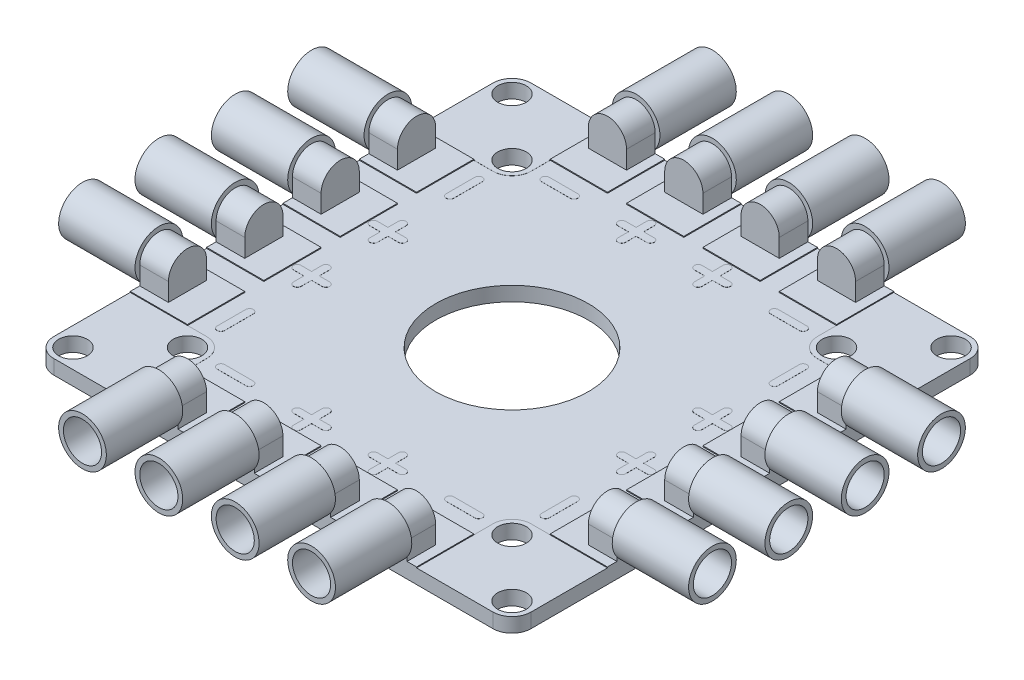
from build123d import *

# Parameters (mm, degrees)
SKETCH1_W           = 50
SKETCH1_H           = 50
SKETCH1_R           = 8
BOSS_EXTRUDE1_DEPTH = 1.5
SKETCH3_R           = 1.5
CUT_EXTRUDE1_DEPTH  = 36.387144558
FILLET2_R           = 2
BOSS_EXTRUDE3_DEPTH = 3
SKETCH6_R           = 2.5
BOSS_EXTRUDE4_DEPTH = 8
SKETCH7_R           = 2
CUT_EXTRUDE4_DEPTH  = 7.5
SKETCH8_W           = 6
SKETCH8_H           = 6
BOSS_EXTRUDE5_DEPTH = 0.1
BOSS_EXTRUDE6_START = 0.01
SKETCH9_R           = 1.5
BOSS_EXTRUDE6_DEPTH = 0.01
BOSS_EXTRUDE7_DEPTH = 0.01
CIRPATTERN1_COUNT   = 4
CIRPATTERN3_COUNT   = 4
CIRPATTERN4_COUNT   = 4
CIRPATTERN5_COUNT   = 4


with BuildPart() as part:
    # Sketch1 → Boss-Extrude1 (new body)
    with BuildSketch(Plane(origin=(0, 0, 0), x_dir=(1, 0, 0), z_dir=(0, 1, 0))):
        Rectangle(SKETCH1_W, SKETCH1_H)
        Circle(SKETCH1_R, mode=Mode.SUBTRACT)
    extrude(amount=BOSS_EXTRUDE1_DEPTH)

    # Sketch3 → Cut-Extrude1 (cut, through all)
    with BuildSketch(Plane(origin=(0, 1.5, 0), x_dir=(1, 0, 0), z_dir=(0, 1, 0))):
        with Locations((-23, -23)):
            Circle(SKETCH3_R)
        with Locations((-17, -17)):
            Circle(SKETCH3_R)
        with Locations((23, -23)):
            Circle(SKETCH3_R)
        with Locations((17, -17)):
            Circle(SKETCH3_R)
        with Locations((23, 23)):
            Circle(SKETCH3_R)
        with Locations((17, 17)):
            Circle(SKETCH3_R)
        with Locations((-23, 23)):
            Circle(SKETCH3_R)
        with Locations((-17, 17)):
            Circle(SKETCH3_R)
    extrude(amount=-CUT_EXTRUDE1_DEPTH, mode=Mode.SUBTRACT)

    # Fillet2
    fillet2_edges = [part.edges().sort_by_distance(p)[0] for p in [
        (25, 0.75, -25),
        (25, 0.75, 25),
        (-25, 0.75, -25),
        (-25, 0.75, 25),
    ]]
    fillet(fillet2_edges, radius=FILLET2_R)

    # Sketch5 → Boss-Extrude3 (add)
    with BuildSketch(Plane.XY.offset(25)):
        with BuildLine():
            Line((-6, 1.5), (-2, 1.5))
            Line((-2, 1.5), (-2, 3.5))
            ThreePointArc((-2, 3.5), (-4, 5.5), (-6, 3.5))
            Line((-6, 3.5), (-6, 1.5))
        make_face()
        with BuildLine():
            Line((10, 3.5), (10, 1.5))
            Line((10, 1.5), (14, 1.5))
            Line((14, 1.5), (14, 3.5))
            ThreePointArc((14, 3.5), (12, 5.5), (10, 3.5))
        make_face()
        with BuildLine():
            Line((2, 3.5), (2, 1.5))
            Line((2, 1.5), (6, 1.5))
            Line((6, 1.5), (6, 3.5))
            ThreePointArc((6, 3.5), (4, 5.5), (2, 3.5))
        make_face()
        with BuildLine():
            Line((-10, 1.5), (-10, 3.5))
            ThreePointArc((-10, 3.5), (-12, 5.5), (-14, 3.5))
            Line((-14, 3.5), (-14, 1.5))
            Line((-14, 1.5), (-10, 1.5))
        make_face()
    boss_extrude3 = extrude(amount=-BOSS_EXTRUDE3_DEPTH)

    # Sketch6 → Boss-Extrude4 (add)
    with BuildSketch(Plane.XY.offset(25)):
        with Locations((12, 3.5)):
            Circle(SKETCH6_R)
        with Locations((4, 3.5)):
            Circle(SKETCH6_R)
        with Locations((-4, 3.5)):
            Circle(SKETCH6_R)
        with Locations((-12, 3.5)):
            Circle(SKETCH6_R)
    boss_extrude4 = extrude(amount=BOSS_EXTRUDE4_DEPTH)

    # Sketch7 → Cut-Extrude4 (cut)
    with BuildSketch(Plane.XY.offset(33)):
        with Locations((-12, 3.5)):
            Circle(SKETCH7_R)
        with Locations((-4, 3.5)):
            Circle(SKETCH7_R)
        with Locations((4, 3.5)):
            Circle(SKETCH7_R)
        with Locations((12, 3.5)):
            Circle(SKETCH7_R)
    cut_extrude4 = extrude(amount=-CUT_EXTRUDE4_DEPTH, mode=Mode.SUBTRACT)

    # Sketch8 → Boss-Extrude5 (add)
    with BuildSketch(Plane(origin=(0, 1.5, 0), x_dir=(1, 0, 0), z_dir=(0, 1, 0))):
        with Locations((12, -22)):
            Rectangle(SKETCH8_W, SKETCH8_H)
        with Locations((-12, -22)):
            Rectangle(SKETCH8_W, SKETCH8_H)
        with Locations((-4, -22)):
            Rectangle(SKETCH8_W, SKETCH8_H)
        with Locations((4, -22)):
            Rectangle(SKETCH8_W, SKETCH8_H)
    boss_extrude5 = extrude(amount=BOSS_EXTRUDE5_DEPTH)

    # Sketch9 → Boss-Extrude6 (add)
    # profile 1 of 4: a face of its own
    with BuildSketch(Plane(origin=(0, 1.5, 0), x_dir=(1, 0, 0), z_dir=(0, 1, 0)).offset(BOSS_EXTRUDE6_START)):
        with BuildLine():
            Line((25, -23), (25, -15))
            Line((25, -15), (17, -15))
            ThreePointArc((17, -15), (15.585786438, -15.585786438), (15, -17))
            Line((15, -17), (15, -25))
            Line((15, -25), (23, -25))
            ThreePointArc((23, -25), (24.414213562, -24.414213562), (25, -23))
        make_face()
        with Locations((23, -23)):
            Circle(SKETCH9_R, mode=Mode.SUBTRACT)
        with Locations((17, -17)):
            Circle(SKETCH9_R, mode=Mode.SUBTRACT)
    # profile 2 of 4: a face of its own
    with BuildSketch(Plane(origin=(0, 1.5, 0), x_dir=(1, 0, 0), z_dir=(0, 1, 0)).offset(BOSS_EXTRUDE6_START)):
        with BuildLine():
            Line((25, 15), (17, 15))
            ThreePointArc((17, 15), (15.585786438, 15.585786438), (15, 17))
            Line((15, 17), (15, 25))
            Line((15, 25), (23, 25))
            ThreePointArc((23, 25), (24.414213562, 24.414213562), (25, 23))
            Line((25, 23), (25, 15))
        make_face()
        with Locations((23, 23)):
            Circle(SKETCH9_R, mode=Mode.SUBTRACT)
        with Locations((17, 17)):
            Circle(SKETCH9_R, mode=Mode.SUBTRACT)
    # profile 3 of 4: a face of its own
    with BuildSketch(Plane(origin=(0, 1.5, 0), x_dir=(1, 0, 0), z_dir=(0, 1, 0)).offset(BOSS_EXTRUDE6_START)):
        with BuildLine():
            Line((-25, 15), (-17, 15))
            ThreePointArc((-17, 15), (-15.585786438, 15.585786438), (-15, 17))
            Line((-15, 17), (-15, 25))
            Line((-15, 25), (-23, 25))
            ThreePointArc((-23, 25), (-24.414213562, 24.414213562), (-25, 23))
            Line((-25, 23), (-25, 15))
        make_face()
        with Locations((-17, 17)):
            Circle(SKETCH9_R, mode=Mode.SUBTRACT)
        with Locations((-23, 23)):
            Circle(SKETCH9_R, mode=Mode.SUBTRACT)
    # profile 4 of 4: a face of its own
    with BuildSketch(Plane(origin=(0, 1.5, 0), x_dir=(1, 0, 0), z_dir=(0, 1, 0)).offset(BOSS_EXTRUDE6_START)):
        with BuildLine():
            Line((-23, -25), (-15, -25))
            Line((-15, -25), (-15, -17))
            ThreePointArc((-15, -17), (-15.585786438, -15.585786438), (-17, -15))
            Line((-17, -15), (-25, -15))
            Line((-25, -15), (-25, -23))
            ThreePointArc((-25, -23), (-24.414213562, -24.414213562), (-23, -25))
        make_face()
        with Locations((-23, -23)):
            Circle(SKETCH9_R, mode=Mode.SUBTRACT)
        with Locations((-17, -17)):
            Circle(SKETCH9_R, mode=Mode.SUBTRACT)
    extrude(amount=-BOSS_EXTRUDE6_DEPTH)

    # Sketch11 → Boss-Extrude7 (add)
    with BuildSketch(Plane(origin=(0, 1.5, 0), x_dir=(1, 0, 0), z_dir=(0, 1, 0))):
        with BuildLine():
            Line((-10.5, -16.6), (-13.5, -16.6))
            ThreePointArc((-13.5, -16.6), (-13.9, -17), (-13.5, -17.4))
            Line((-13.5, -17.4), (-10.5, -17.4))
            ThreePointArc((-10.5, -17.4), (-10.1, -17), (-10.5, -16.6))
        make_face()
        with BuildLine():
            Line((-4.4, -16.6), (-5.5, -16.6))
            ThreePointArc((-5.5, -16.6), (-5.9, -17), (-5.5, -17.4))
            Line((-5.5, -17.4), (-4.4, -17.4))
            Line((-4.4, -17.4), (-4.4, -18.5))
            ThreePointArc((-4.4, -18.5), (-4, -18.9), (-3.6, -18.5))
            Line((-3.6, -18.5), (-3.6, -17.4))
            Line((-3.6, -17.4), (-2.5, -17.4))
            ThreePointArc((-2.5, -17.4), (-2.1, -17), (-2.5, -16.6))
            Line((-2.5, -16.6), (-3.6, -16.6))
            Line((-3.6, -16.6), (-3.6, -15.5))
            ThreePointArc((-3.6, -15.5), (-4, -15.1), (-4.4, -15.5))
            Line((-4.4, -15.5), (-4.4, -16.6))
        make_face()
        with BuildLine():
            Line((3.6, -16.6), (2.5, -16.6))
            ThreePointArc((2.5, -16.6), (2.1, -17), (2.5, -17.4))
            Line((2.5, -17.4), (3.6, -17.4))
            Line((3.6, -17.4), (3.6, -18.5))
            ThreePointArc((3.6, -18.5), (4, -18.9), (4.4, -18.5))
            Line((4.4, -18.5), (4.4, -17.4))
            Line((4.4, -17.4), (5.5, -17.4))
            ThreePointArc((5.5, -17.4), (5.9, -17), (5.5, -16.6))
            Line((5.5, -16.6), (4.4, -16.6))
            Line((4.4, -16.6), (4.4, -15.5))
            ThreePointArc((4.4, -15.5), (4, -15.1), (3.6, -15.5))
            Line((3.6, -15.5), (3.6, -16.6))
        make_face()
        with BuildLine():
            Line((13.5, -16.6), (10.5, -16.6))
            ThreePointArc((10.5, -16.6), (10.1, -17), (10.5, -17.4))
            Line((10.5, -17.4), (13.5, -17.4))
            ThreePointArc((13.5, -17.4), (13.9, -17), (13.5, -16.6))
        make_face()
    boss_extrude7 = extrude(amount=BOSS_EXTRUDE7_DEPTH)

    # CirPattern1: Boss-Extrude7 ×4 about axis
    cirpattern1_axis = Axis((0, 1.5, 0), (0, 1, 0))
    for i in range(1, CIRPATTERN1_COUNT):
        add(boss_extrude7.rotate(cirpattern1_axis, i * 360 / CIRPATTERN1_COUNT))

    # CirPattern3: Boss-Extrude3 ×4 about axis
    cirpattern3_axis = Axis((0, 1.5, 0), (0, 1, 0))
    for i in range(1, CIRPATTERN3_COUNT):
        add(boss_extrude3.rotate(cirpattern3_axis, i * 360 / CIRPATTERN3_COUNT))

    # CirPattern4: Boss-Extrude5 ×4 about axis
    cirpattern4_axis = Axis((0, 1.5, 0), (0, 1, 0))
    for i in range(1, CIRPATTERN4_COUNT):
        add(boss_extrude5.rotate(cirpattern4_axis, i * 360 / CIRPATTERN4_COUNT))

    # CirPattern5: Boss-Extrude4, Cut-Extrude4 ×4 about axis
    cirpattern5_axis = Axis((0, 1.5, 0), (0, 1, 0))
    add([boss_extrude4.rotate(cirpattern5_axis, i * 360 / CIRPATTERN5_COUNT) for i in range(1, CIRPATTERN5_COUNT)])
    add([cut_extrude4.rotate(cirpattern5_axis, i * 360 / CIRPATTERN5_COUNT) for i in range(1, CIRPATTERN5_COUNT)], mode=Mode.SUBTRACT)


solid = part.part
